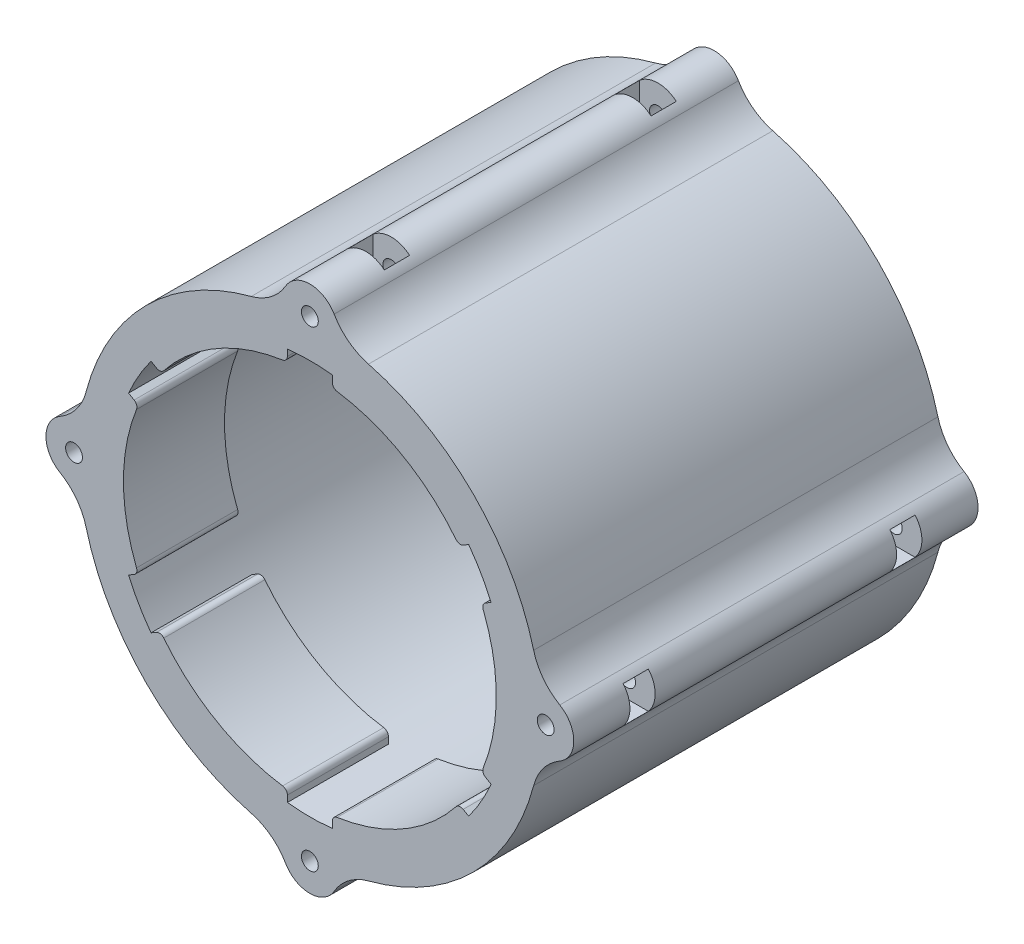
from build123d import *

# Parameters (mm, degrees)
IZIM1_R                     = 35.2
IZIM1_R_2                   = 1.5
Y_KSEKLIK_EKSTR_ZYON1_DEPTH = 72
Y_KSEKLIK_EKSTR_ZYON2_START = -18
Y_KSEKLIK_EKSTR_ZYON2_DEPTH = 18
KES_EKSTR_ZYON1_DEPTH       = 4.5
DAIRESEL_KAPLAMA1_COUNT     = 4
AYNALAMA1_COPY_1_DEPTH      = 4.5
AYNALAMA1_COPY_2_DEPTH      = 4.5
AYNALAMA1_COPY_3_DEPTH      = 4.5
RADYUS1_R                   = 1


with BuildPart() as part:
    # Çizim1 → Yükseklik-Ekstrüzyon1 (new body)
    with BuildSketch(Plane.XY):
        with BuildLine():
            ThreePointArc((-39.855405506, -10.439667234), (-29.132799385, -29.132799385), (-10.439667234, -39.855405506))
            ThreePointArc((-10.439667234, -39.855405506), (-6.917154276, -41.571669638), (-4.324522349, -44.50968254))
            ThreePointArc((-4.324522349, -44.50968254), (0, -47), (4.324522349, -44.50968254))
            ThreePointArc((4.324522349, -44.50968254), (6.917154276, -41.571669638), (10.439667234, -39.855405506))
            ThreePointArc((10.439667234, -39.855405506), (29.132799385, -29.132799385), (39.855405506, -10.439667234))
            ThreePointArc((39.855405506, -10.439667234), (41.571669638, -6.917154276), (44.50968254, -4.324522349))
            ThreePointArc((44.50968254, -4.324522349), (47, 0), (44.50968254, 4.324522349))
            ThreePointArc((44.50968254, 4.324522349), (41.571669638, 6.917154276), (39.855405506, 10.439667234))
            ThreePointArc((39.855405506, 10.439667234), (29.132799385, 29.132799385), (10.439667234, 39.855405506))
            ThreePointArc((10.439667234, 39.855405506), (6.917154276, 41.571669638), (4.324522349, 44.50968254))
            ThreePointArc((4.324522349, 44.50968254), (0, 47), (-4.324522349, 44.50968254))
            ThreePointArc((-4.324522349, 44.50968254), (-6.917154276, 41.571669638), (-10.439667234, 39.855405506))
            ThreePointArc((-10.439667234, 39.855405506), (-29.132799385, 29.132799385), (-39.855405506, 10.439667234))
            ThreePointArc((-39.855405506, 10.439667234), (-41.571669638, 6.917154276), (-44.50968254, 4.324522349))
            ThreePointArc((-44.50968254, 4.324522349), (-47, 0), (-44.50968254, -4.324522349))
            ThreePointArc((-44.50968254, -4.324522349), (-41.571669638, -6.917154276), (-39.855405506, -10.439667234))
        make_face()
        Circle(IZIM1_R, mode=Mode.SUBTRACT)
        with Locations((-42, 0)):
            Circle(IZIM1_R_2, mode=Mode.SUBTRACT)
        with Locations((0, 42)):
            Circle(IZIM1_R_2, mode=Mode.SUBTRACT)
        with Locations((42, 0)):
            Circle(IZIM1_R_2, mode=Mode.SUBTRACT)
        with Locations((0, -42)):
            Circle(IZIM1_R_2, mode=Mode.SUBTRACT)
    extrude(amount=Y_KSEKLIK_EKSTR_ZYON1_DEPTH)

    # Çizim2 → Yükseklik-Ekstrüzyon2 (add)
    with BuildSketch(Plane.XY.offset(72).offset(Y_KSEKLIK_EKSTR_ZYON2_START)):
        with BuildLine():
            Line((-4, 34.971988791), (-4, 32.958155288))
            ThreePointArc((-4, 32.958155288), (-16.6, 28.752043406), (-26.542599741, 19.943179259))
            Line((-26.542599741, 19.943179259), (-28.286630714, 20.950096011))
            ThreePointArc((-28.286630714, 20.950096011), (-17.6, 30.484094213), (-4, 34.971988791))
        make_face()
        with BuildLine():
            Line((4, 34.971988791), (4, 32.958155288))
            ThreePointArc((4, 32.958155288), (16.6, 28.752043406), (26.542599741, 19.943179259))
            Line((26.542599741, 19.943179259), (28.286630714, 20.950096011))
            ThreePointArc((28.286630714, 20.950096011), (17.6, 30.484094213), (4, 34.971988791))
        make_face()
        with BuildLine():
            Line((32.286630714, 14.02189278), (30.542599741, 13.014976029))
            ThreePointArc((30.542599741, 13.014976029), (33.2, 0), (30.542599741, -13.014976029))
            Line((30.542599741, -13.014976029), (32.286630714, -14.02189278))
            ThreePointArc((32.286630714, -14.02189278), (35.2, 0), (32.286630714, 14.02189278))
        make_face()
        with BuildLine():
            Line((28.286630714, -20.950096011), (26.542599741, -19.943179259))
            ThreePointArc((26.542599741, -19.943179259), (16.6, -28.752043406), (4, -32.958155288))
            Line((4, -32.958155288), (4, -34.971988791))
            ThreePointArc((4, -34.971988791), (17.6, -30.484094213), (28.286630714, -20.950096011))
        make_face()
        with BuildLine():
            Line((-4, -34.971988791), (-4, -32.958155288))
            ThreePointArc((-4, -32.958155288), (-16.6, -28.752043406), (-26.542599741, -19.943179259))
            Line((-26.542599741, -19.943179259), (-28.286630714, -20.950096011))
            ThreePointArc((-28.286630714, -20.950096011), (-17.6, -30.484094213), (-4, -34.971988791))
        make_face()
        with BuildLine():
            Line((-32.286630714, -14.02189278), (-30.542599741, -13.014976029))
            ThreePointArc((-30.542599741, -13.014976029), (-33.2, 0), (-30.542599741, 13.014976029))
            Line((-30.542599741, 13.014976029), (-32.286630714, 14.02189278))
            ThreePointArc((-32.286630714, 14.02189278), (-35.2, 0), (-32.286630714, -14.02189278))
        make_face()
    extrude(amount=Y_KSEKLIK_EKSTR_ZYON2_DEPTH)

    # Çizim3 → Kes-Ekstrüzyon1 (cut)
    with BuildSketch(Plane(origin=(0, 0, 10), x_dir=(-1, 0, 0), z_dir=(0, 0, -1))):
        Polygon((-3.262029021, -42), (-3.262029021, -48), (3.262029021, -48), (3.262029021, -42), (1.63101451, -39.175), (-1.63101451, -39.175), align=None)
    kes_ekstr_zyon1 = extrude(amount=-KES_EKSTR_ZYON1_DEPTH, mode=Mode.SUBTRACT)

    # Dairesel Kaplama1: Kes-Ekstrüzyon1 ×4 about axis
    dairesel_kaplama1_axis = Axis((0, 0, 0), (0, 0, 1))
    for i in range(1, DAIRESEL_KAPLAMA1_COUNT):
        add(kes_ekstr_zyon1.rotate(dairesel_kaplama1_axis, i * 360 / DAIRESEL_KAPLAMA1_COUNT), mode=Mode.SUBTRACT)

    # Aynalama1: Kes-Ekstrüzyon1 across plane
    add(kes_ekstr_zyon1.mirror(Plane(origin=(0, 0, 36), x_dir=(1, 0, 0), z_dir=(0, 0, -1))), mode=Mode.SUBTRACT)

    # Aynalama1 copy 1 sketch → Aynalama1 copy 1 (cut)
    with BuildSketch(Plane(origin=(0, 0, 62), x_dir=(0, -1, 0), z_dir=(0, 0, 1))):
        Polygon((-3.262029021, 42), (-3.262029021, 48), (3.262029021, 48), (3.262029021, 42), (1.63101451, 39.175), (-1.63101451, 39.175), align=None)
    extrude(amount=-AYNALAMA1_COPY_1_DEPTH, mode=Mode.SUBTRACT)

    # Aynalama1 copy 2 sketch → Aynalama1 copy 2 (cut)
    with BuildSketch(Plane.XY.offset(62)):
        Polygon((-3.262029021, 42), (-3.262029021, 48), (3.262029021, 48), (3.262029021, 42), (1.63101451, 39.175), (-1.63101451, 39.175), align=None)
    extrude(amount=-AYNALAMA1_COPY_2_DEPTH, mode=Mode.SUBTRACT)

    # Aynalama1 copy 3 sketch → Aynalama1 copy 3 (cut)
    with BuildSketch(Plane(origin=(0, 0, 62), x_dir=(0, 1, 0), z_dir=(0, 0, 1))):
        Polygon((-3.262029021, 42), (-3.262029021, 48), (3.262029021, 48), (3.262029021, 42), (1.63101451, 39.175), (-1.63101451, 39.175), align=None)
    extrude(amount=-AYNALAMA1_COPY_3_DEPTH, mode=Mode.SUBTRACT)

    # Radyus1
    radyus1_edges = [part.edges().sort_by_distance(p)[0] for p in [
        (4, -32.958155288, 63),
        (26.542599741, -19.943179259, 63),
        (-26.542599741, -19.943179259, 63),
        (-4, -32.958155288, 63),
        (-30.542599741, 13.014976029, 63),
        (-30.542599741, -13.014976029, 63),
        (26.542599741, 19.943179259, 63),
        (4, 32.958155288, 63),
        (-4, 32.958155288, 63),
        (-26.542599741, 19.943179259, 63),
        (30.542599741, -13.014976029, 63),
        (30.542599741, 13.014976029, 63),
    ]]
    fillet(radyus1_edges, radius=RADYUS1_R)


solid = part.part
